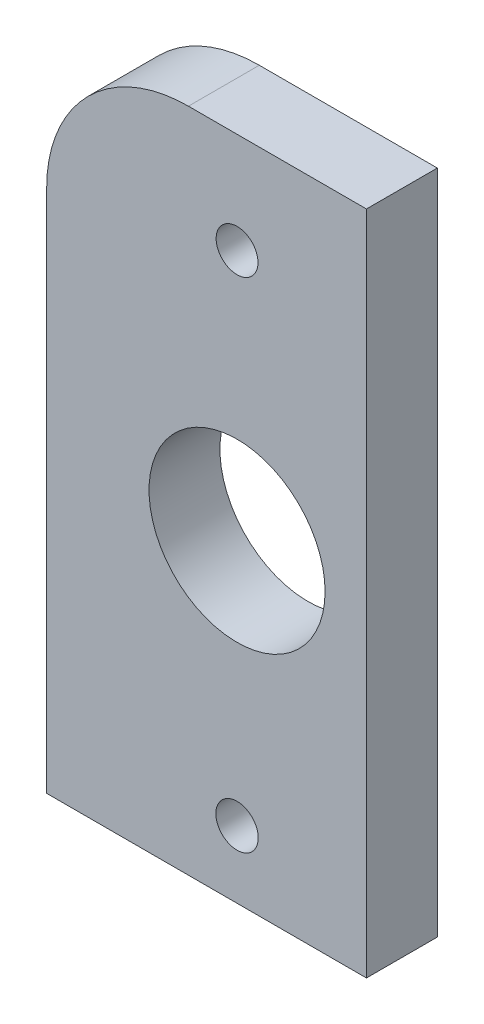
from build123d import *

# Parameters (mm, degrees)
SKETCH1_R           = 1.5
SKETCH1_R_2         = 1.517913389
BOSS_EXTRUDE1_DEPTH = 5.08


with BuildPart() as part:
    # Sketch1 → Boss-Extrude1 (new body)
    with BuildSketch(Plane(origin=(0, 0, 0), x_dir=(-1, 0, 0), z_dir=(0, 0, 1))):
        with BuildLine():
            Line((94.361674585, -64.328592097), (94.361674585, -111.794978321))
            Line((94.361674585, -111.794978321), (94.361674585, -112.062374013))
            Line((94.361674585, -112.062374013), (107.121412131, -112.062374013))
            ThreePointArc((107.121412131, -112.062374013), (114.305617027, -109.08657891), (117.281412131, -101.902374013))
            Line((117.281412131, -101.902374013), (117.281412131, -64.328592097))
            Line((117.281412131, -64.328592097), (94.361674585, -64.328592097))
        make_face()
        with Locations((103.635582515, -104.844491412)):
            Circle(SKETCH1_R, mode=Mode.SUBTRACT)
        with BuildLine():
            ThreePointArc((109.76359006, -88.328738191), (97.326662127, -86.828738191), (109.76359006, -85.328738191))
            ThreePointArc((109.76359006, -85.328738191), (109.944502904, -86.828738191), (109.76359006, -88.328738191))
        make_face(mode=Mode.SUBTRACT)
        with Locations((103.635582515, -69.140487693)):
            Circle(SKETCH1_R_2, mode=Mode.SUBTRACT)
    extrude(amount=BOSS_EXTRUDE1_DEPTH)


solid = part.part
